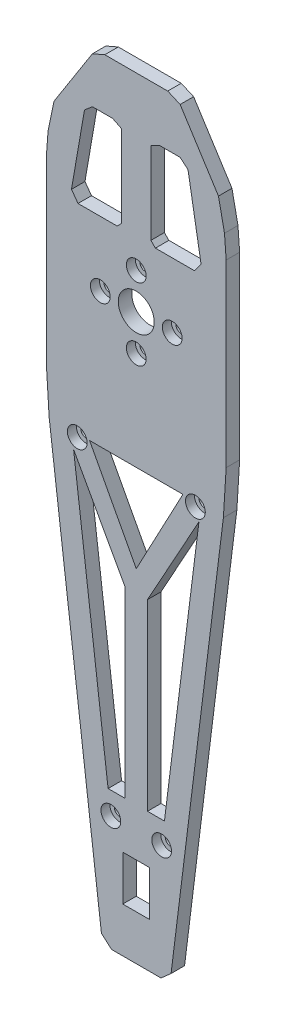
from build123d import *

# Parameters (mm, degrees)
BOSS_EXTRUDE1_DEPTH            = 3
SKETCH3_R                      = 4
CUT_EXTRUDE1_DEPTH             = 3
CBORE_FOR_M2_SHCS1_D           = 2.4
CBORE_FOR_M2_SHCS1_DEPTH       = 3
CBORE_FOR_M2_SHCS1_CBORE_D     = 4.4
CBORE_FOR_M2_SHCS1_CBORE_DEPTH = 2
CBORE_FOR_M2_SHCS1_TIP         = 0.721032743
CUT_EXTRUDE2_DEPTH             = 3
SKETCH7_W                      = 6
SKETCH7_H                      = 10
CUT_EXTRUDE3_DEPTH             = 3
CUT_EXTRUDE4_DEPTH             = 3
CBORE_FOR_M2_SHCS2_D           = 2.4
CBORE_FOR_M2_SHCS2_DEPTH       = 3
CBORE_FOR_M2_SHCS2_CBORE_D     = 4.4
CBORE_FOR_M2_SHCS2_CBORE_DEPTH = 2
CBORE_FOR_M2_SHCS2_TIP         = 0.721032743
SALIENTE_EXTRUIR2_DEPTH        = 3
CORTAR_EXTRUIR2_DEPTH          = 25
CORTAR_EXTRUIR3_DEPTH          = 8
CORTAR_EXTRUIR3_DEPTH_BACK     = 1
SALIENTE_EXTRUIR3_DEPTH        = 3
CORTAR_EXTRUIR4_DEPTH          = 32
CORTAR_EXTRUIR4_DEPTH_BACK     = 3
CORTAR_EXTRUIR5_DEPTH          = 33
CORTAR_EXTRUIR5_DEPTH_BACK     = 16
CORTAR_EXTRUIR6_DEPTH          = 36
CORTAR_EXTRUIR6_DEPTH_BACK     = 57
CROQUIS10_W                    = 8
CROQUIS10_H                    = 20.24327749
CROQUIS11_W                    = 22.516217108
CROQUIS11_H                    = 6.585791746
SALIENTE_EXTRUIR4_DEPTH        = 3
CORTAR_EXTRUIR7_DEPTH          = 12
CORTAR_EXTRUIR7_DEPTH_BACK     = 26
CORTAR_EXTRUIR8_DEPTH          = 37
CORTAR_EXTRUIR8_DEPTH_BACK     = 23
CORTAR_EXTRUIR10_DEPTH         = 10
CORTAR_EXTRUIR10_DEPTH_BACK    = 13
CROQUIS14_W                    = 22.056135014
CROQUIS14_H                    = 3.895510455
CORTAR_EXTRUIR11_DEPTH         = 15
CORTAR_EXTRUIR11_DEPTH_BACK    = 12
CROQUIS15_W                    = 4.816352665
CROQUIS15_H                    = 5.664480242
CORTAR_EXTRUIR12_DEPTH         = 33
CORTAR_EXTRUIR12_DEPTH_BACK    = 21
CORTAR_EXTRUIR18_DEPTH         = 52
CORTAR_EXTRUIR18_DEPTH_BACK    = 75
CORTAR_EXTRUIR19_DEPTH         = 24
CORTAR_EXTRUIR19_DEPTH_BACK    = 67
CORTAR_EXTRUIR20_DEPTH         = 39
CORTAR_EXTRUIR20_DEPTH_BACK    = 62
SALIENTE_EXTRUIR7_DEPTH        = 3
SALIENTE_EXTRUIR9_DEPTH        = 3
SALIENTE_EXTRUIR10_DEPTH       = 3


with BuildPart() as part:
    # Sketch2 → Boss-Extrude1 (new body)
    with BuildSketch(Plane.XY):
        Polygon((-5.811176978, -98.599598559), (-3.564526654, -100.58433119), (7.435473346, -100.58433119), (9.68212367, -98.599598559), (21.318847535, -4.961831578), (21.935473346, 5), (21.935473346, 45), (21.193771081, 54.944681764), (15.17717561, 95.055318236), (9.435473346, 100), (-5.564526654, 100), (-11.306228919, 95.055318236), (-17.32282439, 54.944681764), (-18.064526654, 45), (-18.064526654, 5), (-17.447900844, -4.961831578), align=None)
    extrude(amount=BOSS_EXTRUDE1_DEPTH)

    # Sketch3 → Cut-Extrude1 (cut)
    with BuildSketch(Plane.XY.offset(3)):
        with Locations((1.935473346, 25)):
            Circle(SKETCH3_R)
    extrude(amount=-CUT_EXTRUDE1_DEPTH, mode=Mode.SUBTRACT)

    # CBORE for M2 SHCS1
    with Locations(Plane.XY.offset(3)):
        with Locations((1.935473346, 33), (9.935473346, 25), (1.935473346, 17), (-6.064526654, 25)):
            CounterBoreHole(CBORE_FOR_M2_SHCS1_D / 2, CBORE_FOR_M2_SHCS1_CBORE_D / 2, CBORE_FOR_M2_SHCS1_CBORE_DEPTH, depth=CBORE_FOR_M2_SHCS1_DEPTH)
            with Locations((0, 0, -(CBORE_FOR_M2_SHCS1_DEPTH + CBORE_FOR_M2_SHCS1_TIP / 2))):  # 118° drill point
                Cone(0, CBORE_FOR_M2_SHCS1_D / 2, CBORE_FOR_M2_SHCS1_TIP, mode=Mode.SUBTRACT)

    # Sketch6 → Cut-Extrude2 (cut)
    with BuildSketch(Plane.XY.offset(3)):
        Polygon((-10.32282439, 54.944681764), (-2.592495206, 54.944681764), (-0.592495206, 56.944681764), (-0.592495206, 77.986977382), (-2.570367912, 80.283658288), (-6.413140682, 80.860074204), (-8.687694294, 79.178882404), (-12.026143484, 56.92255447), align=None)
        Polygon((15.841153071, 56.92255447), (12.502703881, 79.178882404), (10.22815027, 80.860074204), (6.385377499, 80.283658288), (4.407504794, 77.986977382), (4.407504794, 56.944681764), (6.407504794, 54.944681764), (14.137833977, 54.944681764), align=None)
        Polygon((-4.417484259, 94.313615971), (8.232493846, 94.313615971), (10.529174752, 92.335743265), (11.167639805, 88.07930958), (9.486448005, 85.804755968), (1.907504794, 84.667914487), (-5.671438417, 85.804755968), (-7.352630217, 88.07930958), (-6.714165164, 92.335743265), align=None)
    extrude(amount=-CUT_EXTRUDE2_DEPTH, mode=Mode.SUBTRACT)

    # Sketch7 → Cut-Extrude3 (cut)
    with BuildSketch(Plane.XY.offset(3)):
        with Locations((1.935473346, -85.58433119)):
            Rectangle(SKETCH7_W, SKETCH7_H)
    extrude(amount=-CUT_EXTRUDE3_DEPTH, mode=Mode.SUBTRACT)

    # Sketch8 → Cut-Extrude4 (cut)
    with BuildSketch(Plane.XY.offset(3)):
        Polygon((-8.447900844, -4.961831578), (12.318847535, -4.961831578), (1.935473346, -24.483157151), align=None)
        Polygon((15.880690917, -8.470858754), (8.202586605, -69.961831578), (4.435473346, -69.961831578), (4.435473346, -29.183297302), align=None)
        Polygon((-12.009744226, -8.470858754), (-4.331639914, -69.961831578), (-0.564526654, -69.961831578), (-0.564526654, -29.183297302), align=None)
    extrude(amount=-CUT_EXTRUDE4_DEPTH, mode=Mode.SUBTRACT)

    # CBORE for M2 SHCS2
    with Locations(Plane.XY.offset(3)):
        with Locations((-3.715014103, -74.923663156), (7.581217459, -74.961831578), (-11.190875883, -5.696432584), (15.095204577, -5.939721308), (1.907504794, 81.167914487)):
            CounterBoreHole(CBORE_FOR_M2_SHCS2_D / 2, CBORE_FOR_M2_SHCS2_CBORE_D / 2, CBORE_FOR_M2_SHCS2_CBORE_DEPTH, depth=CBORE_FOR_M2_SHCS2_DEPTH)
            with Locations((0, 0, -(CBORE_FOR_M2_SHCS2_DEPTH + CBORE_FOR_M2_SHCS2_TIP / 2))):  # 118° drill point
                Cone(0, CBORE_FOR_M2_SHCS2_D / 2, CBORE_FOR_M2_SHCS2_TIP, mode=Mode.SUBTRACT)

    # Croquis2 → Saliente-Extruir2 (add)
    with BuildSketch(Plane.XY):
        Polygon((18.794620774, 54.944681764), (-14.944396603, 54.944681764), (-7.478946257, 96.267482636), (12.143583194, 96.267482636), align=None)
    extrude(amount=SALIENTE_EXTRUIR2_DEPTH)

    # Croquis3 → Cortar-Extruir2 (cut)
    with BuildSketch(Plane.XY):
        Polygon((3.935473346, 75), (15.193771081, 54.944681764), (9.17717561, 95.055318236), (3.935473346, 95.055318236), align=None)
        Polygon((-5.306228919, 95.055318236), (-11.32282439, 54.944681764), (-0.064526654, 75), (-0.064526654, 95.055318236), align=None)
        Polygon((1.935473346, 67.392726007), (10.193771081, 54.944681764), (-6.32282439, 54.944681764), align=None)
    extrude(amount=CORTAR_EXTRUIR2_DEPTH, mode=Mode.SUBTRACT)

    # Croquis4 → Cortar-Extruir3 (cut, two sides: drawn at the far end of the back side and taken through both)
    with BuildSketch(Plane.XY.offset(-CORTAR_EXTRUIR3_DEPTH_BACK)):
        Polygon((-16.681169013, 74.945942972), (0, 74.945942972), (20.337076697, 74.945942972), (20.337076697, 106.026068233), (-16.681169013, 106.026068233), align=None)
    extrude(amount=CORTAR_EXTRUIR3_DEPTH + CORTAR_EXTRUIR3_DEPTH_BACK, mode=Mode.SUBTRACT)

    # Croquis5 → Saliente-Extruir3 (add)
    with BuildSketch(Plane.XY):
        Polygon((-14.322635208, 74.945942972), (18.1935819, 74.945942972), (18.1935819, 53.950721804), (-16.161111671, 53.950721804), align=None)
    extrude(amount=SALIENTE_EXTRUIR3_DEPTH)

    # Croquis8 → Cortar-Extruir4 (cut, two sides: drawn at the far end of the back side and taken through both)
    with BuildSketch(Plane.XY.offset(-CORTAR_EXTRUIR4_DEPTH_BACK)):
        Polygon((-14.322635208, 74.945942972), (-15.372635208, 67.945942972), (-9.322635208, 74.945942972), align=None)
        Polygon((18.1935819, 74.945942972), (13.1935819, 74.945942972), (19.2435819, 67.945942972), align=None)
    extrude(amount=CORTAR_EXTRUIR4_DEPTH + CORTAR_EXTRUIR4_DEPTH_BACK, mode=Mode.SUBTRACT)

    # Croquis9 → Cortar-Extruir5 (cut, two sides: drawn at the far end of the back side and taken through both)
    with BuildSketch(Plane.XY.offset(-CORTAR_EXTRUIR5_DEPTH_BACK)):
        Polygon((-9.322635208, 67.945942972), (-9.322635208, 70.912384295), (13.1935819, 70.912384295), (13.1935819, 67.945942972), (13.1935819, 64.326592549), (-9.322635208, 64.326592549), align=None)
    extrude(amount=CORTAR_EXTRUIR5_DEPTH + CORTAR_EXTRUIR5_DEPTH_BACK, mode=Mode.SUBTRACT)

    # Croquis10 → Cortar-Extruir6 (cut, two sides: drawn at the far end of the back side and taken through both)
    with BuildSketch(Plane.XY.offset(-CORTAR_EXTRUIR6_DEPTH_BACK)):
        with Locations((-5.322635208, 49.537038019)):
            Rectangle(CROQUIS10_W, CROQUIS10_H)
        with Locations((9.1935819, 49.537038019)):
            Rectangle(CROQUIS10_W, CROQUIS10_H)
    extrude(amount=CORTAR_EXTRUIR6_DEPTH + CORTAR_EXTRUIR6_DEPTH_BACK, mode=Mode.SUBTRACT)

    # Croquis11 → Saliente-Extruir4 (add)
    with BuildSketch(Plane.XY):
        with Locations((1.935473346, 67.619488422)):
            Rectangle(CROQUIS11_W, CROQUIS11_H)
    extrude(amount=SALIENTE_EXTRUIR4_DEPTH)

    # Croquis12 → Cortar-Extruir7 (cut, two sides: drawn at the far end of the back side and taken through both)
    with BuildSketch(Plane.XY.offset(-CORTAR_EXTRUIR7_DEPTH_BACK)):
        Polygon((-15.372635208, 67.945942972), (-9.322635208, 74.945942972), (-5.822635208, 74.945942972), (-17.32282439, 54.944681764), align=None)
    extrude(amount=CORTAR_EXTRUIR7_DEPTH + CORTAR_EXTRUIR7_DEPTH_BACK, mode=Mode.SUBTRACT)

    # Croquis13 → Cortar-Extruir8 (cut, two sides: drawn at the far end of the back side and taken through both)
    with BuildSketch(Plane.XY.offset(-CORTAR_EXTRUIR8_DEPTH_BACK)):
        Polygon((13.1935819, 74.945942972), (9.6935819, 74.945942972), (21.193771081, 54.944681764), (19.2435819, 67.945942972), align=None)
    extrude(amount=CORTAR_EXTRUIR8_DEPTH + CORTAR_EXTRUIR8_DEPTH_BACK, mode=Mode.SUBTRACT)

    # Croquis14 → Cortar-Extruir10 (cut, two sides: drawn at the far end of the back side and taken through both)
    with BuildSketch(Plane.XY.offset(-CORTAR_EXTRUIR10_DEPTH_BACK)):
        with Locations((5.205432299, 72.998187745)):
            Rectangle(CROQUIS14_W, CROQUIS14_H)
    extrude(amount=CORTAR_EXTRUIR10_DEPTH + CORTAR_EXTRUIR10_DEPTH_BACK, mode=Mode.SUBTRACT)

    # Croquis15 → Cortar-Extruir11 (cut, two sides: drawn at the far end of the back side and taken through both)
    with BuildSketch(Plane.XY.offset(-CORTAR_EXTRUIR11_DEPTH_BACK)):
        with Locations((-8.230811541, 73.882672638)):
            Rectangle(CROQUIS15_W, CROQUIS15_H)
    extrude(amount=CORTAR_EXTRUIR11_DEPTH + CORTAR_EXTRUIR11_DEPTH_BACK, mode=Mode.SUBTRACT)

    # Croquis16 → Cortar-Extruir12 (cut, two sides: drawn at the far end of the back side and taken through both)
    with BuildSketch(Plane.XY.offset(-CORTAR_EXTRUIR12_DEPTH_BACK)):
        Polygon((-8.062449324, 71.050432517), (-7.062449324, 71.050432517), (-17.32282439, 54.944681764), align=None)
        Polygon((11.933396016, 71.050432517), (10.933396016, 71.050432517), (21.193771081, 54.944681764), align=None)
    extrude(amount=CORTAR_EXTRUIR12_DEPTH + CORTAR_EXTRUIR12_DEPTH_BACK, mode=Mode.SUBTRACT)

    # Croquis18 → Cortar-Extruir18 (cut, two sides: drawn at the far end of the back side and taken through both)
    with BuildSketch(Plane.XY.offset(-CORTAR_EXTRUIR18_DEPTH_BACK)):
        Polygon((-7.062449324, 71.050432517), (-5.062449324, 71.050432517), (-7.826924714, 69.850432517), align=None)
        Polygon((10.933396016, 71.050432517), (8.933396016, 71.050432517), (11.697871405, 69.850432517), align=None)
    extrude(amount=CORTAR_EXTRUIR18_DEPTH + CORTAR_EXTRUIR18_DEPTH_BACK, mode=Mode.SUBTRACT)

    # Croquis20 → Cortar-Extruir19 (cut, two sides: drawn at the far end of the back side and taken through both)
    with BuildSketch(Plane.XY.offset(-CORTAR_EXTRUIR19_DEPTH_BACK)):
        Polygon((21.193771081, 54.944681764), (20.226639816, 56.462791483), (21.564622213, 49.972340882), align=None)
        Polygon((-17.32282439, 54.944681764), (-16.355693125, 56.462791483), (-17.693675522, 49.972340882), align=None)
    extrude(amount=CORTAR_EXTRUIR19_DEPTH + CORTAR_EXTRUIR19_DEPTH_BACK, mode=Mode.SUBTRACT)

    # Croquis21 → Cortar-Extruir20 (cut, two sides: drawn at the far end of the back side and taken through both)
    with BuildSketch(Plane.XY.offset(-CORTAR_EXTRUIR20_DEPTH_BACK)):
        Polygon((-9.322635208, 39.415399274), (-12.822635208, 39.415399274), (-9.322635208, 59.658676764), align=None)
        Polygon((13.1935819, 39.415399274), (16.6935819, 39.415399274), (13.1935819, 59.658676764), align=None)
    extrude(amount=CORTAR_EXTRUIR20_DEPTH + CORTAR_EXTRUIR20_DEPTH_BACK, mode=Mode.SUBTRACT)

    # Croquis23 → Saliente-Extruir7 (add)
    with BuildSketch(Plane.XY):
        Polygon((-9.322635208, 59.658676764), (-9.581980564, 58.158676764), (-7.822635208, 59.658676764), align=None)
        Polygon((13.1935819, 59.658676764), (11.6935819, 59.658676764), (13.452927256, 58.158676764), align=None)
    extrude(amount=SALIENTE_EXTRUIR7_DEPTH)

    # Croquis24 → Saliente-Extruir9 (add)
    with BuildSketch(Plane.XY):
        Polygon((-12.822635208, 39.415399274), (-11.022635208, 39.415399274), (-12.476841401, 41.415399274), align=None)
        Polygon((-1.322635208, 39.415399274), (-1.322635208, 40.415399274), (-2.322635208, 39.415399274), align=None)
        Polygon((5.1935819, 39.415399274), (6.1935819, 39.415399274), (5.1935819, 40.415399274), align=None)
        Polygon((14.8935819, 39.415399274), (16.347788092, 41.415399274), (16.6935819, 39.415399274), align=None)
    extrude(amount=SALIENTE_EXTRUIR9_DEPTH)

    # Croquis25 → Saliente-Extruir10 (add)
    with BuildSketch(Plane.XY):
        Polygon((5.1935819, 59.658676764), (5.1935819, 58.658676764), (7.1935819, 59.658676764), align=None)
        Polygon((-1.322635208, 58.658676764), (-3.322635208, 59.658676764), (-1.322635208, 59.658676764), align=None)
    extrude(amount=SALIENTE_EXTRUIR10_DEPTH)


solid = part.part
